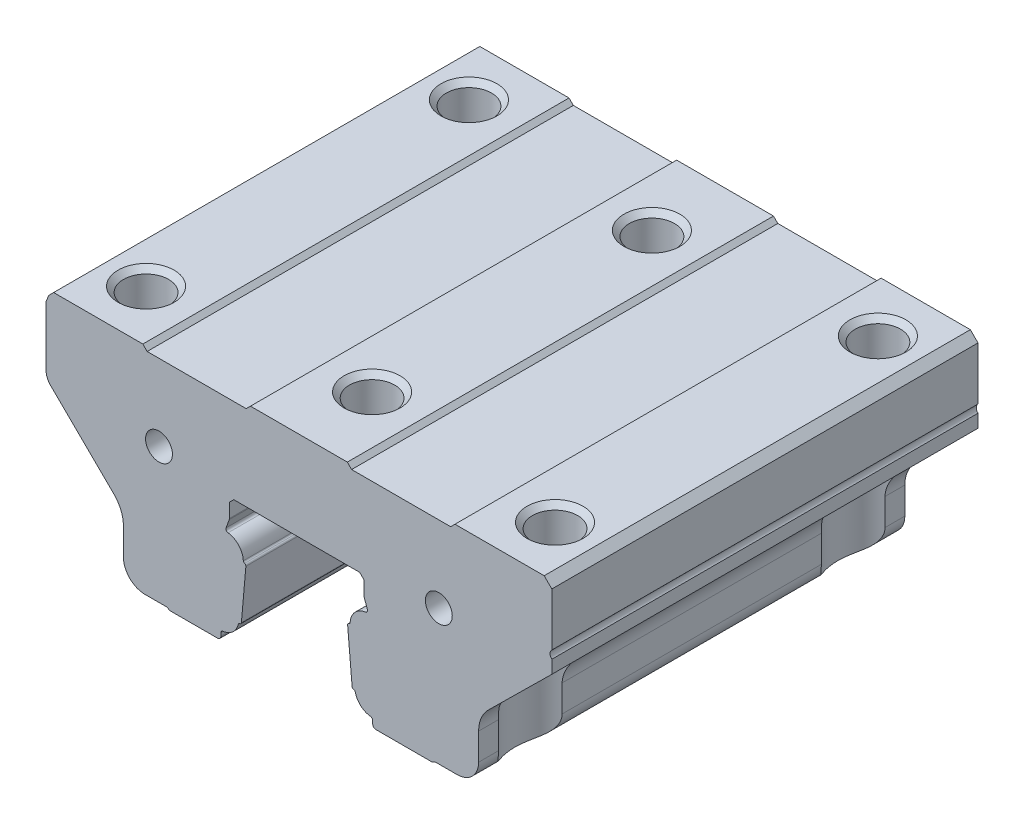
from build123d import *

# Parameters (mm, degrees)
EXTRUDE1_DEPTH               = 19.8
LPATTERN1_COUNT              = 2
LPATTERN1_PITCH              = 30
LPATTERN1_COUNT_DIR2         = 2
LPATTERN1_PITCH_DIR2         = 38
LPATTERN2_COUNT              = 2
LPATTERN2_PITCH              = 26
M2_5_TAPPED_HOLE1_AT_2_COUNT = 2
M2_5_TAPPED_HOLE1_AT_2_PITCH = 26
CHAMFER1_SIZE                = 0.5
FILLET1_R                    = 0.3


with BuildPart() as part:
    # Sketch2 → Extrude1 (new, symmetric)
    with BuildSketch(Plane(origin=(0, 0, 0), x_dir=(-1, 0, 0), z_dir=(0, 0, -1))):
        with BuildLine():
            Line((23.240500776, 9.650007655), (22.790500778, 10.100007653))
            Line((22.790500778, 10.100007653), (14.500500775, 10.100007653))
            Line((14.500500775, 10.100007653), (14.100500772, 9.700007651))
            Line((14.100500772, 9.700007651), (5.884513573, 9.700007651))
            Line((5.884513573, 9.700007651), (4.900500777, 9.700007651))
            Line((4.900500777, 9.700007651), (4.500500777, 10.10000765))
            Line((4.500500777, 10.10000765), (-4.499499223, 10.10000765))
            Line((-4.499499223, 10.10000765), (-4.899499222, 9.700007651))
            Line((-4.899499222, 9.700007651), (-5.884513573, 9.700007651))
            Line((-5.884513573, 9.700007651), (-14.099499221, 9.700007651))
            Line((-14.099499221, 9.700007651), (-14.49949922, 10.10000765))
            Line((-14.49949922, 10.10000765), (-22.789499219, 10.10000765))
            Line((-22.789499219, 10.10000765), (-23.239499217, 9.650007652))
            Line((-23.239499217, 9.650007652), (-23.5, 9.389506869))
            Line((-23.5, 9.389506869), (-23.5, 4.472917228))
            ThreePointArc((-23.5, 4.472917228), (-23.379924304, 4.305564578), (-23.337499221, 4.104007651))
            ThreePointArc((-23.337499221, 4.104007651), (-23.379924304, 3.902450725), (-23.5, 3.735098076))
            Line((-23.5, 3.735098076), (-23.5, 2.521714326))
            Line((-23.5, 2.521714326), (-17.578178859, -3.321313552))
            ThreePointArc((-17.578178859, -3.321313552), (-16.927811777, -4.297766853), (-16.699493407, -5.448553154))
            Line((-16.699493407, -5.448553154), (-16.699493407, -7.950007648))
            ThreePointArc((-16.699493407, -7.950007648), (-16.11370697, -9.36422121), (-14.699493408, -9.950007648))
            Line((-14.699493408, -9.950007648), (-12.774497944, -9.950007648))
            ThreePointArc((-12.774497944, -9.950007648), (-12.580848776, -9.989030425), (-12.417426522, -10.100007648))
            Line((-12.417426522, -10.100007648), (-6.856635968, -10.100007648))
            Line((-6.856635968, -10.100007648), (-6.856635968, -9.520416544))
            ThreePointArc((-6.856635968, -9.520416544), (-6.798400872, -9.367837553), (-6.653314151, -9.292860766))
            ThreePointArc((-6.653314151, -9.292860766), (-5.744042846, -8.885983144), (-5.237643876, -8.028146453))
            ThreePointArc((-5.237643876, -8.028146453), (-5.185555819, -7.939367571), (-5.091942691, -7.896572269))
            ThreePointArc((-5.091942691, -7.896572269), (-4.989874883, -7.845596791), (-4.942586319, -7.741769394))
            Line((-4.942586319, -7.741769394), (-4.527813642, -3.000895922))
            ThreePointArc((-4.527813642, -3.000895922), (-4.527325689, -2.993451206), (-4.527162935, -2.98599229))
            ThreePointArc((-4.527162935, -2.98599229), (-4.559760924, -2.885563792), (-4.645126483, -2.823424967))
            ThreePointArc((-4.645126483, -2.823424967), (-4.727781174, -2.76491971), (-4.762849704, -2.669920441))
            ThreePointArc((-4.762849704, -2.669920441), (-5.194723131, -1.644926648), (-6.181017589, -1.130776694))
            ThreePointArc((-6.181017589, -1.130776694), (-6.346249118, -1.022271671), (-6.365433031, -0.825531295))
            Line((-6.365433031, -0.825531295), (-6.067585284, -0.007201337))
            ThreePointArc((-6.067585284, -0.007201337), (-6.054050745, 0.043310253), (-6.04949307, 0.095404706))
            Line((-6.04949307, 0.095404706), (-6.04949307, 1.399956139))
            Line((-6.04949307, 1.399956139), (-5.649493391, 1.800008502))
            Line((-5.649493391, 1.800008502), (6.050506591, 1.800008502))
            Line((6.050506591, 1.800008502), (6.450506271, 1.399956139))
            Line((6.450506271, 1.399956139), (6.450506271, 0.095404706))
            ThreePointArc((6.450506271, 0.095404706), (6.455063945, 0.043310253), (6.468598484, -0.007201337))
            Line((6.468598484, -0.007201337), (6.766446231, -0.825531295))
            ThreePointArc((6.766446231, -0.825531295), (6.776777596, -0.864088475), (6.78025662, -0.903853908))
            ThreePointArc((6.78025662, -0.903853908), (6.723721522, -1.054508671), (6.582030789, -1.130776694))
            ThreePointArc((6.582030789, -1.130776694), (5.59573633, -1.644926647), (5.163862903, -2.669920441))
            ThreePointArc((5.163862903, -2.669920441), (5.128794373, -2.76491971), (5.046139682, -2.823424967))
            ThreePointArc((5.046139682, -2.823424967), (4.956525222, -2.891696388), (4.928826841, -3.000895922))
            Line((4.928826841, -3.000895922), (5.343599519, -7.741769394))
            ThreePointArc((5.343599519, -7.741769394), (5.390888083, -7.84559679), (5.49295589, -7.896572268))
            ThreePointArc((5.49295589, -7.896572268), (5.586569017, -7.93936757), (5.638657075, -8.028146452))
            ThreePointArc((5.638657075, -8.028146452), (6.145056045, -8.885983143), (7.05432735, -9.292860764))
            ThreePointArc((7.05432735, -9.292860764), (7.19941407, -9.367837551), (7.257649167, -9.520416542))
            Line((7.257649167, -9.520416542), (7.257649167, -10.100007648))
            Line((7.257649167, -10.100007648), (12.024054476, -10.100007648))
            ThreePointArc((12.024054476, -10.100007648), (12.18747673, -9.989030425), (12.381125898, -9.950007648))
            Line((12.381125898, -9.950007648), (14.306121361, -9.950007648))
            ThreePointArc((14.306121361, -9.950007648), (15.720334923, -9.36422121), (16.306121361, -7.950007648))
            Line((16.306121361, -7.950007648), (16.306121361, -5.442633035))
            ThreePointArc((16.306121361, -5.442633035), (16.53448271, -4.294582867), (17.184800819, -3.321312888))
            Line((17.184800819, -3.321312888), (23.060660562, 2.460668215))
            ThreePointArc((23.060660562, 2.460668215), (23.385819404, 2.947303103), (23.5, 3.521327996))
            Line((23.5, 3.521327996), (23.5, 8.996129021))
            Line((23.5, 8.996129021), (23.240500776, 9.650007655))
        make_face()
    extrude(amount=EXTRUDE1_DEPTH, both=True)

    # Sketch3 → Cut-Revolve1 (revolve, cut)
    with BuildSketch(Plane.XY.offset(15)):
        Polygon((-21.1, 10.100007653), (-21.1, 3.100007653), (-22.75, 3.100007653), (-22.75, -10.100007648), (-19, -10.100007648), (-19, 10.100007653), align=None)
    cut_revolve1 = revolve(axis=Axis((-19, 22.686890445, 15), (0, -1, 0)), mode=Mode.SUBTRACT)

    # LPattern1: Cut-Revolve1 2 × 2
    with Locations(*[(j * LPATTERN1_PITCH_DIR2, 0, -i * LPATTERN1_PITCH) for i in range(LPATTERN1_COUNT) for j in range(LPATTERN1_COUNT_DIR2) if (i, j) != (0, 0)]):
        add(cut_revolve1, mode=Mode.SUBTRACT)

    # Sketch4 → Cut-Revolve2 (revolve, cut)
    with BuildSketch(Plane.XY.offset(13), mode=Mode.PRIVATE) as cut_revolve2_sk:
        Polygon((-2.1, 10.10000765), (-2.1, 5.60000765), (-3.75, 5.60000765), (-3.75, 1.800008502), (0, 1.800008502), (0, 10.10000765), align=None)
    cut_revolve2 = revolve(cut_revolve2_sk.sketch.rotate(Axis((0, 0, 13), (0, 1, 0)), 270), axis=Axis((0, 0, 13), (0, 1, 0)), mode=Mode.SUBTRACT)

    # LPattern2: Cut-Revolve2 ×2
    with Locations(*[(0, 0, -i * LPATTERN2_PITCH) for i in range(1, LPATTERN2_COUNT)]):
        add(cut_revolve2, mode=Mode.SUBTRACT)

    # Sketch6 → M2.5 Tapped Hole1 (revolve, cut)
    with BuildSketch(Plane(origin=(-13, 2.599992352, 19.8), x_dir=(0, -1, 0), z_dir=(1, 0, 0))):
        Polygon((0, 0), (0, 6.965882135), (1.025, 6.35), (1.025, 5), (1.25, 5), (1.25, 0), align=None)
    m2_5_tapped_hole1 = revolve(axis=Axis((-13, 2.599992352, 26.15), (0, 0, -1)), mode=Mode.SUBTRACT)

    # M2.5 Tapped Hole1 at 2: M2.5 Tapped Hole1 ×2
    with Locations(*[(i * M2_5_TAPPED_HOLE1_AT_2_PITCH, 0, 0) for i in range(1, M2_5_TAPPED_HOLE1_AT_2_COUNT)]):
        add(m2_5_tapped_hole1, mode=Mode.SUBTRACT)

    # Mirror1: M2.5 Tapped Hole1 across plane
    add(m2_5_tapped_hole1.mirror(Plane.XY), mode=Mode.SUBTRACT)

    # Mirror1 copy 1 sketch → Mirror1 copy 1 (revolve, cut)
    with BuildSketch(Plane(origin=(13, 2.599992352, -19.8), x_dir=(0, -1, 0), z_dir=(1, 0, 0))):
        Polygon((0, 0), (0, -6.965882135), (1.025, -6.35), (1.025, -5), (1.25, -5), (1.25, 0), align=None)
    revolve(axis=Axis((13, 2.599992352, -26.15), (0, 0, -1)), mode=Mode.SUBTRACT)

    # Chamfer1
    chamfer1_edges = [part.edges().sort_by_distance(p)[0] for p in [
        (-16.9, 10.100007653, 15),
        (21.1, 10.100007653, 15),
        (-16.9, 10.100007653, -15),
        (21.1, 10.100007653, -15),
        (0, 10.10000765, 15.1),
        (0, 10.10000765, -10.9),
    ]]
    chamfer(chamfer1_edges, length=CHAMFER1_SIZE)

    # Fillet1
    fillet1_edges = [part.edges().sort_by_distance(p)[0] for p in [
        (6.856635968, -10.100007648, 0),
        (-7.257649167, -10.100007648, 0),
    ]]
    fillet(fillet1_edges, radius=FILLET1_R)


solid = part.part
